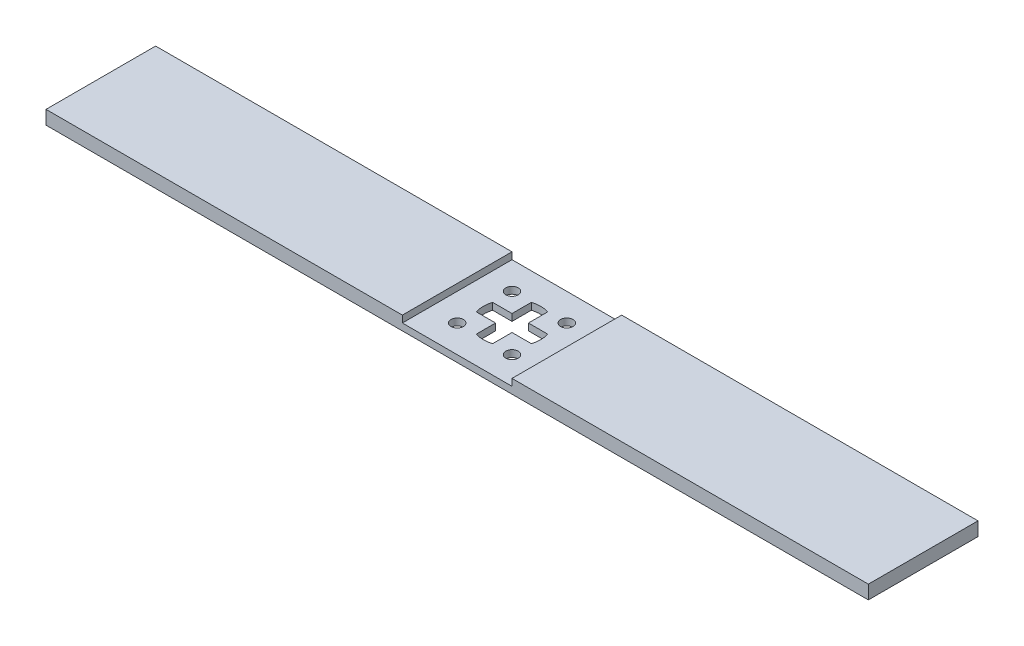
from build123d import *

# Parameters (mm, degrees)
SKETCH1_W           = 300
SKETCH1_H           = 40
SKETCH1_R           = 2.25
BOSS_EXTRUDE1_DEPTH = 2.5
SKETCH2_W           = 40
SKETCH2_H           = 2.5
CUT_EXTRUDE1_DEPTH  = 156.261875552


with BuildPart() as part:
    # Sketch1 → Boss-Extrude1 (new, symmetric)
    with BuildSketch(Plane(origin=(0, 0, 0), x_dir=(1, 0, 0), z_dir=(0, 1, 0))):
        Rectangle(SKETCH1_W, SKETCH1_H)
        with Locations(Location((10, -10, 0), (0, 0, 270))):
            Circle(SKETCH1_R, mode=Mode.SUBTRACT)
        with Locations(Location((10, 10, 0), (0, 0, 90))):
            Circle(SKETCH1_R, mode=Mode.SUBTRACT)
        with Locations(Location((-10, -10, 0), (0, 0, 90))):
            Circle(SKETCH1_R, mode=Mode.SUBTRACT)
        with Locations(Location((-10, 10, 0), (0, 0, 270))):
            Circle(SKETCH1_R, mode=Mode.SUBTRACT)
        with BuildLine():
            Line((-3, -3), (-3, -10.062305899))
            ThreePointArc((-3, -10.062305899), (0, -10.5), (3, -10.062305899))
            Line((3, -10.062305899), (3, -3))
            Line((3, -3), (10.062305899, -3))
            ThreePointArc((10.062305899, -3), (10.5, 0), (10.062305899, 3))
            Line((10.062305899, 3), (3, 3))
            Line((3, 3), (3, 10.062305899))
            ThreePointArc((3, 10.062305899), (0, 10.5), (-3, 10.062305899))
            Line((-3, 10.062305899), (-3, 3))
            Line((-3, 3), (-10.062305899, 3))
            ThreePointArc((-10.062305899, 3), (-10.5, 0), (-10.062305899, -3))
            Line((-10.062305899, -3), (-3, -3))
        make_face(mode=Mode.SUBTRACT)
    extrude(amount=BOSS_EXTRUDE1_DEPTH, both=True)

    # Sketch2 → Cut-Extrude1 (cut, through all)
    with BuildSketch(Plane.XY.offset(20)):
        with Locations((0, 1.25)):
            Rectangle(SKETCH2_W, SKETCH2_H)
    extrude(amount=-CUT_EXTRUDE1_DEPTH, mode=Mode.SUBTRACT)


solid = part.part
